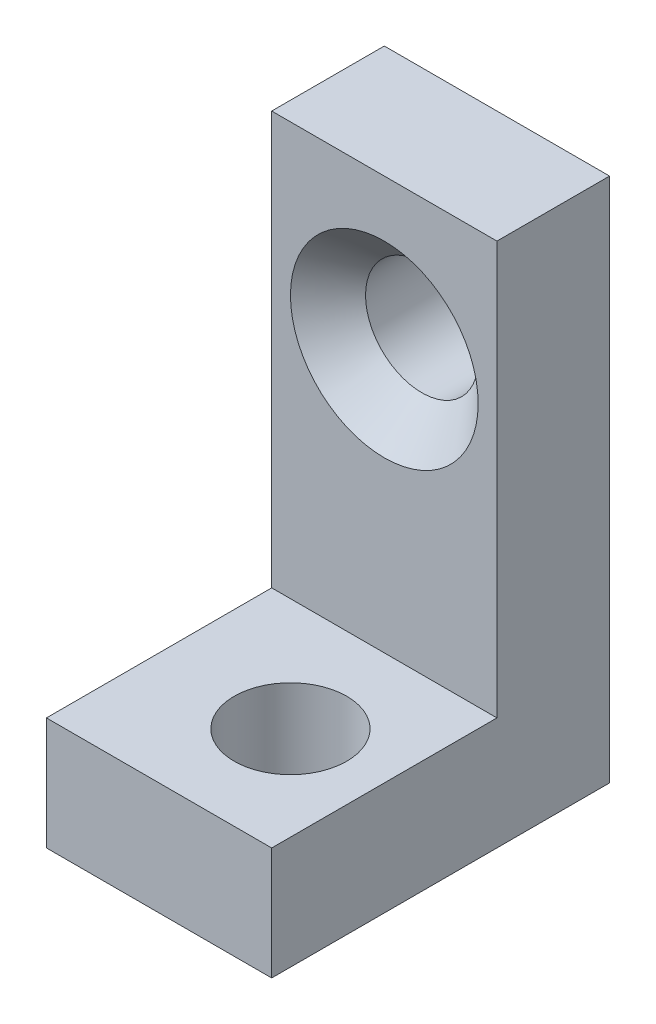
from build123d import *

# Parameters (mm, degrees)
ESQUISSE1_W             = 6
ESQUISSE1_H             = 14
ESQUISSE1_R             = 1.5
BOSS_EXTRU_1_DEPTH      = 3
ESQUISSE2_W             = 6
ESQUISSE2_H             = 3
BOSS_EXTRU_2_DEPTH      = 6
ESQUISSE3_R             = 1.5
ENL_V_MAT_EXTRU_1_DEPTH = 10
CHANFREIN3_SIZE         = 1


with BuildPart() as part:
    # Esquisse1 → Boss.-Extru.1 (new body)
    with BuildSketch(Plane.XY):
        with Locations((-1.02739726, -0.01369863)):
            Rectangle(ESQUISSE1_W, ESQUISSE1_H)
        with Locations((-1.02739726, 2.98630137)):
            Circle(ESQUISSE1_R, mode=Mode.SUBTRACT)
    extrude(amount=BOSS_EXTRU_1_DEPTH)

    # Esquisse2 → Boss.-Extru.2 (add)
    with BuildSketch(Plane.XY.offset(3)):
        with Locations((-1.02739726, -5.51369863)):
            Rectangle(ESQUISSE2_W, ESQUISSE2_H)
    extrude(amount=BOSS_EXTRU_2_DEPTH)

    # Esquisse3 → Enlèv. mat.-Extru.1 (cut)
    with BuildSketch(Plane(origin=(0, -7.01369863, 0), x_dir=(-1, 0, 0), z_dir=(0, -1, 0))):
        with Locations(Location((0.52739726, -6, 0), (0, 0, 90))):
            Circle(ESQUISSE3_R)
    extrude(amount=-ENL_V_MAT_EXTRU_1_DEPTH, mode=Mode.SUBTRACT)

    # Chanfrein3
    chanfrein3_edges = [part.edges().sort_by_distance(p)[0] for p in [
        (-2.52739726, 2.98630137, 3),
    ]]
    chamfer(chanfrein3_edges, length=CHANFREIN3_SIZE)


solid = part.part
